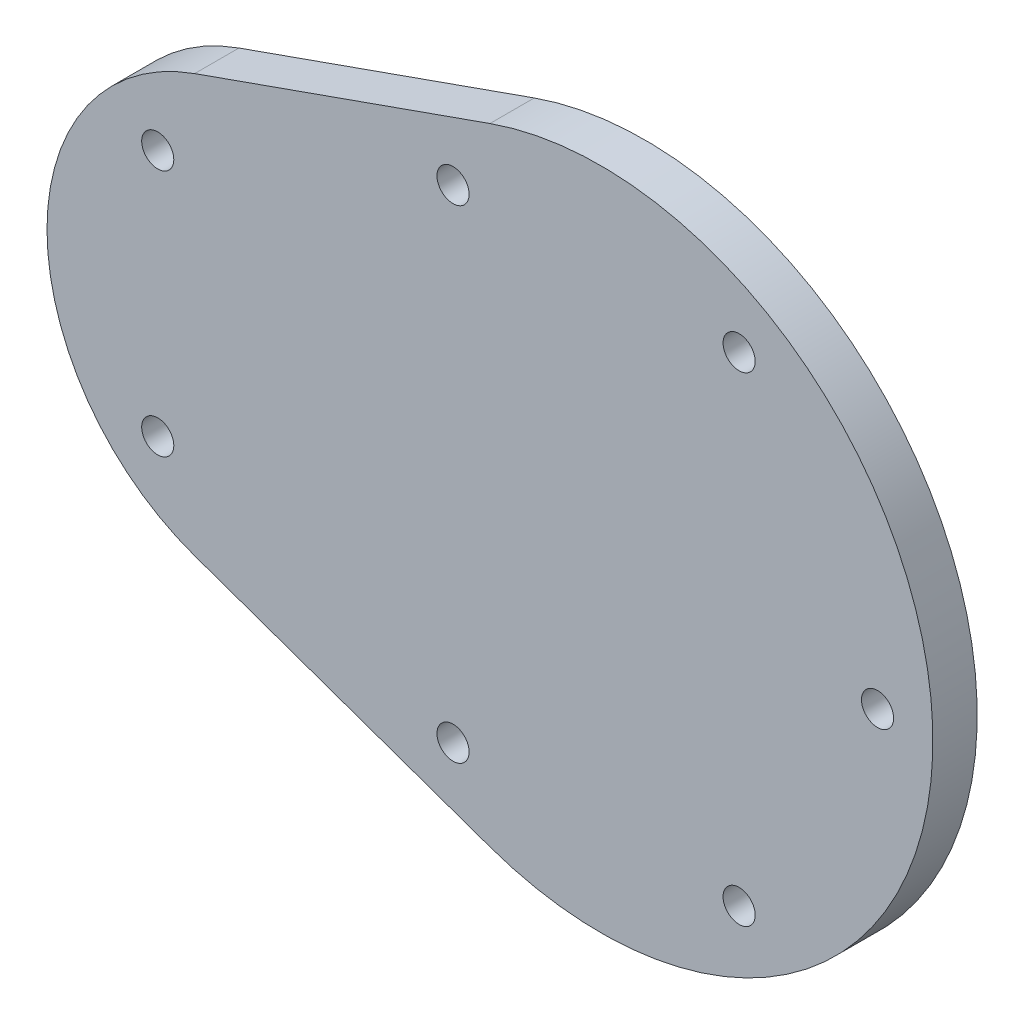
from build123d import *

# Parameters (mm, degrees)
BOSS_EXTRU_1_DEPTH   = 8
D_GAGEMENT_M52_D     = 5.8
D_GAGEMENT_M52_DEPTH = 90
D_GAGEMENT_M52_TIP   = 1.742495795


with BuildPart() as part:
    # Esquisse1 → Boss.-Extru.1 (new body)
    with BuildSketch(Plane.XY):
        with BuildLine():
            Line((-20, 56.568542495), (-73.333333333, 37.712361663))
            ThreePointArc((-73.333333333, 37.712361663), (-100, 0), (-73.333333333, -37.712361663))
            Line((-73.333333333, -37.712361663), (-20, -56.568542495))
            ThreePointArc((-20, -56.568542495), (34.641016151, -48.989794856), (60, 0))
            ThreePointArc((60, 0), (34.641016151, 48.989794856), (-20, 56.568542495))
        make_face()
    extrude(amount=BOSS_EXTRU_1_DEPTH)

    # Dégagement M52
    with Locations(Plane(origin=(15, 0, 8), x_dir=(0, 1, 0), z_dir=(0, 0, 1))):
        with Locations((43.604918173, 41.666666667), (0, -35), (-43.301270189, -10), (43.301270189, -10), (-22.360679775, 95), (22.360679775, 95), (-43.604918173, 41.666666667)):
            Hole(D_GAGEMENT_M52_D / 2, depth=D_GAGEMENT_M52_DEPTH)
            with Locations((0, 0, -(D_GAGEMENT_M52_DEPTH + D_GAGEMENT_M52_TIP / 2))):  # 118° drill point
                Cone(0, D_GAGEMENT_M52_D / 2, D_GAGEMENT_M52_TIP, mode=Mode.SUBTRACT)


solid = part.part
